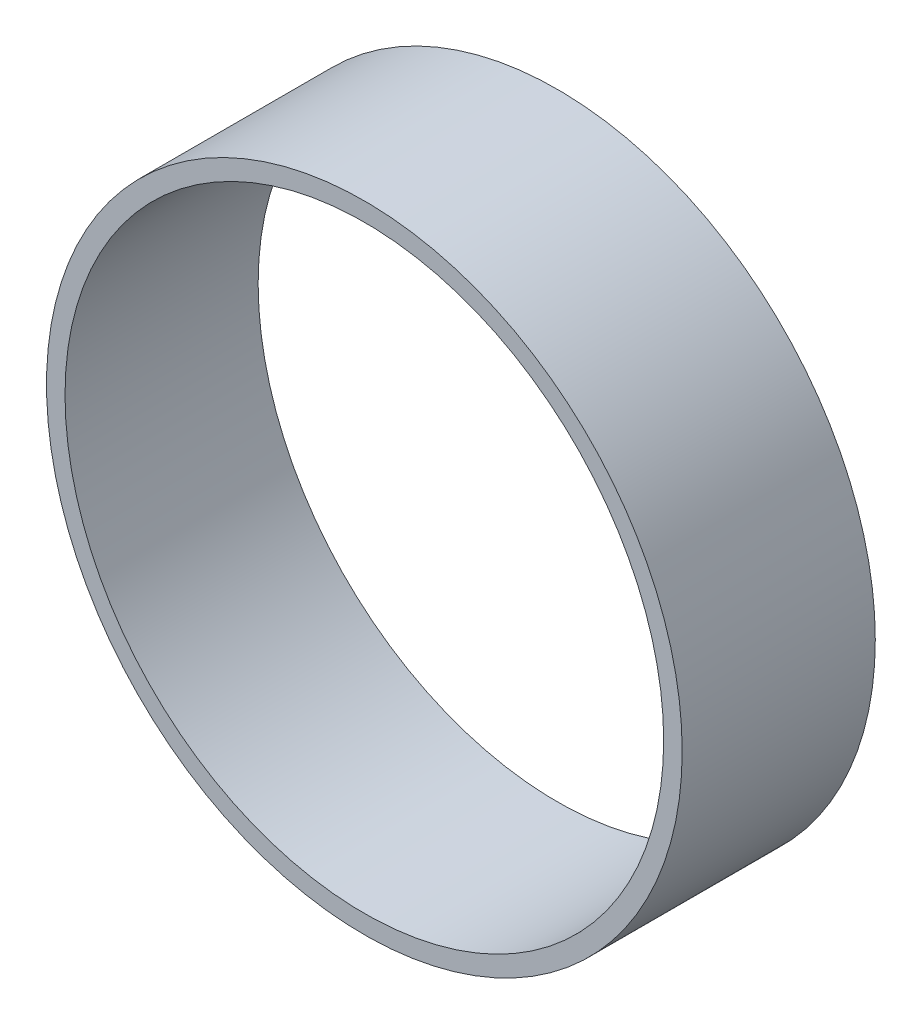
from build123d import *

# Parameters (mm, degrees)
ESQUISSE1_R        = 19.75
ESQUISSE1_R_2      = 18.6
BOSS_EXTRU_1_DEPTH = 12


with BuildPart() as part:
    # Esquisse1 → Boss.-Extru.1 (new body)
    with BuildSketch(Plane.XY):
        Circle(ESQUISSE1_R)
        Circle(ESQUISSE1_R_2, mode=Mode.SUBTRACT)
    extrude(amount=BOSS_EXTRU_1_DEPTH)


solid = part.part
